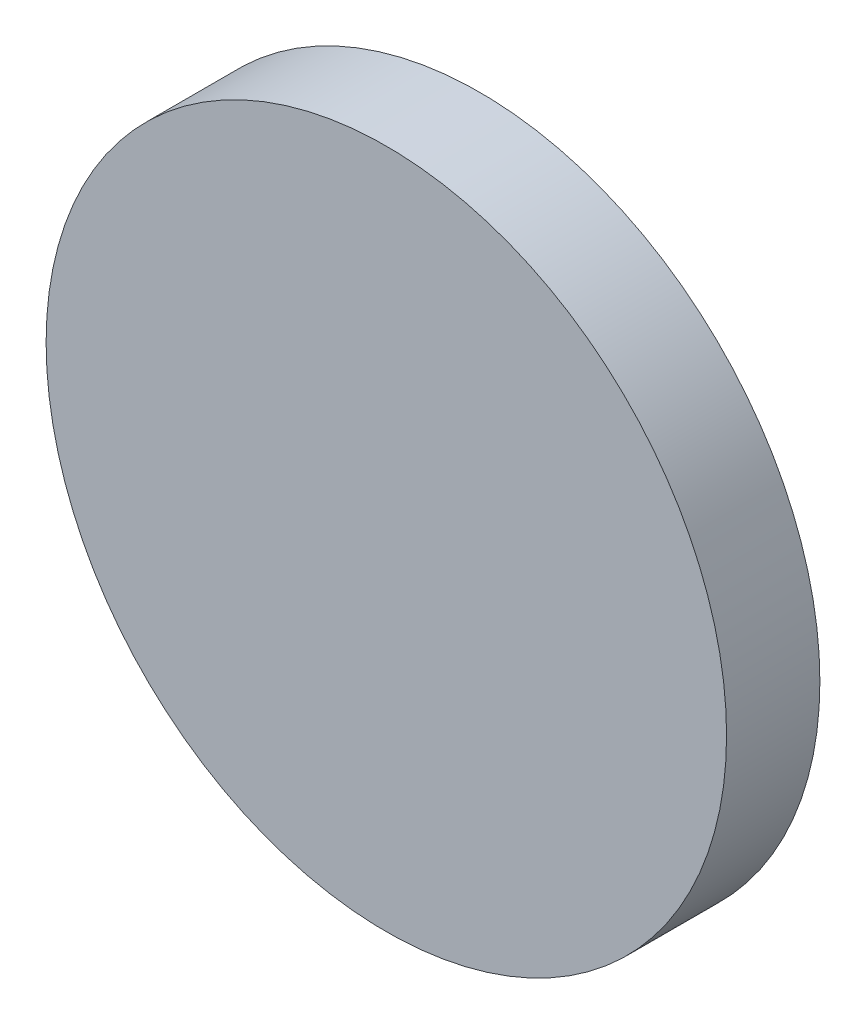
from build123d import *

# Parameters (mm, degrees)
SKETCH_1_R      = 72.922629372
EXTRUDE_1_DEPTH = 20


with BuildPart() as part:
    # Эскиз1 → Бобышка-Вытянуть1 (new body)
    with BuildSketch(Plane.XY):
        with Locations((-69.018121028, 21.204975485)):
            Circle(SKETCH_1_R)
    extrude(amount=EXTRUDE_1_DEPTH)


solid = part.part
